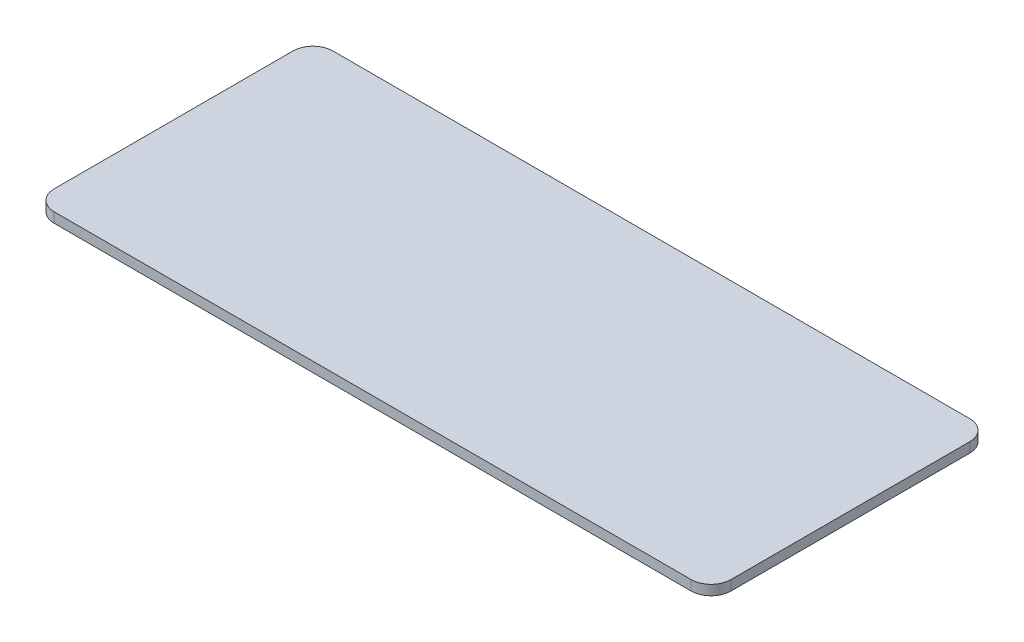
from build123d import *

# Parameters (mm, degrees)
EXTRUDE_1_DEPTH = 1


with BuildPart() as part:
    # 草图1 → 凸台-拉伸1 (new body)
    with BuildSketch(Plane(origin=(0, 0, 0), x_dir=(1, 0, 0), z_dir=(0, 1, 0))):
        with BuildLine():
            Line((-33.366834171, 14.778894472), (30.633165829, 14.778894472))
            ThreePointArc((30.633165829, 14.778894472), (32.047379392, 14.193108035), (32.633165829, 12.778894472))
            Line((32.633165829, 12.778894472), (32.633165829, -11.221105528))
            ThreePointArc((32.633165829, -11.221105528), (32.047379392, -12.63531909), (30.633165829, -13.221105528))
            Line((30.633165829, -13.221105528), (-33.366834171, -13.221105528))
            ThreePointArc((-33.366834171, -13.221105528), (-34.781047733, -12.63531909), (-35.366834171, -11.221105528))
            Line((-35.366834171, -11.221105528), (-35.366834171, 12.778894472))
            ThreePointArc((-35.366834171, 12.778894472), (-34.781047733, 14.193108035), (-33.366834171, 14.778894472))
        make_face()
    extrude(amount=EXTRUDE_1_DEPTH)


solid = part.part
